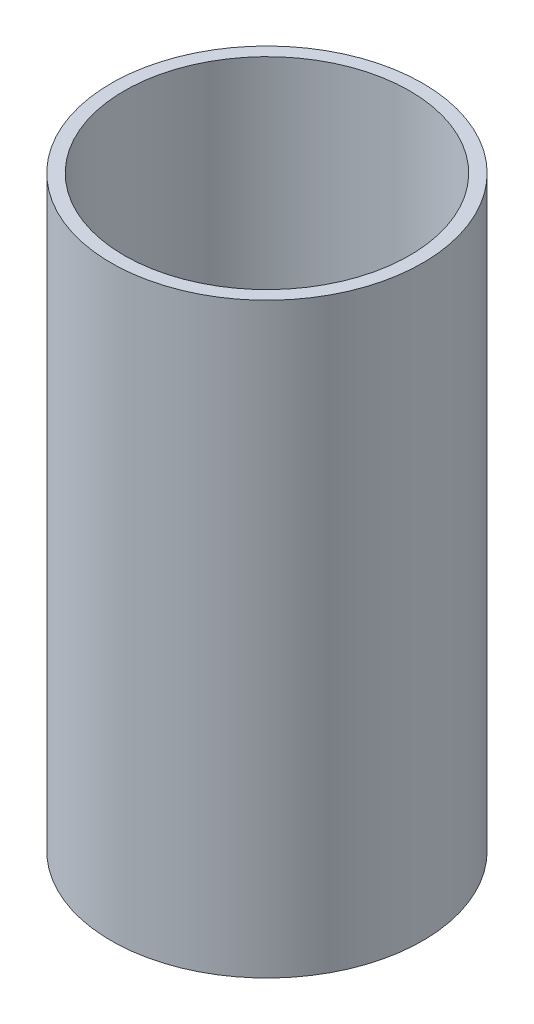
from build123d import *

# Parameters (mm, degrees)
SKETCH2_R           = 23.875
SKETCH2_R_2         = 21.875
BOSS_EXTRUDE2_DEPTH = 90


with BuildPart() as part:
    # Sketch2 → Boss-Extrude2 (new body)
    with BuildSketch(Plane(origin=(0, 0, 0), x_dir=(1, 0, 0), z_dir=(0, 1, 0))):
        with Locations(Location((0, 0, 0), (0, 0, 90))):
            Circle(SKETCH2_R)
        with Locations(Location((0, 0, 0), (0, 0, 90))):
            Circle(SKETCH2_R_2, mode=Mode.SUBTRACT)
    extrude(amount=BOSS_EXTRUDE2_DEPTH)


solid = part.part
